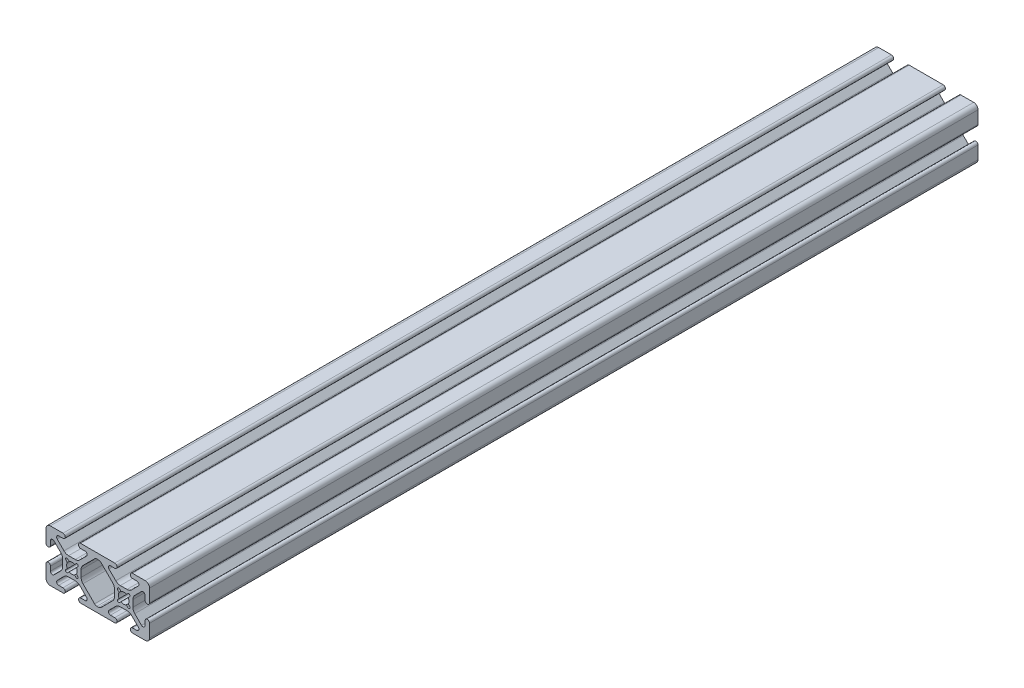
from build123d import *

# Parameters (mm, degrees)
EXTRUDE1_DEPTH = 406.4


with BuildPart() as part:
    # Sketch1 → Extrude1 (new body)
    with BuildSketch(Plane.XY):
        with BuildLine():
            Line((8.3439, -10.4902), (6.225100202, -10.4902))
            ThreePointArc((6.225100202, -10.4902), (5.286438597, -9.863006367), (5.506679712, -8.75577951))
            Line((5.506679712, -8.75577951), (8.81535611, -5.447103113))
            ThreePointArc((8.81535611, -5.447103113), (9.845400242, -4.758849627), (11.06042014, -4.517167143))
            Line((11.06042014, -4.517167143), (14.33957986, -4.517167143))
            ThreePointArc((14.33957986, -4.517167143), (15.554599758, -4.758849627), (16.58464389, -5.447103113))
            Line((16.58464389, -5.447103113), (19.893320288, -8.75577951))
            ThreePointArc((19.893320288, -8.75577951), (20.113561403, -9.863006367), (19.174899798, -10.4902))
            Line((19.174899798, -10.4902), (17.0561, -10.4902))
            ThreePointArc((17.0561, -10.4902), (15.9512, -11.5951), (17.0561, -12.7))
            Line((17.0561, -12.7), (23.2918, -12.7))
            ThreePointArc((23.2918, -12.7), (24.782522516, -12.082522516), (25.4, -10.5918))
            Line((25.4, -10.5918), (25.4, -4.3561))
            ThreePointArc((25.4, -4.3561), (24.2951, -3.2512), (23.1902, -4.3561))
            Line((23.1902, -4.3561), (23.1902, -6.474899798))
            ThreePointArc((23.1902, -6.474899798), (22.563006367, -7.413561403), (21.45577951, -7.193320288))
            Line((21.45577951, -7.193320288), (18.147103113, -3.88464389))
            ThreePointArc((18.147103113, -3.88464389), (17.458849627, -2.854599758), (17.217167143, -1.63957986))
            Line((17.217167143, -1.63957986), (17.217167143, 1.63957986))
            ThreePointArc((17.217167143, 1.63957986), (17.458849627, 2.854599758), (18.147103113, 3.88464389))
            Line((18.147103113, 3.88464389), (21.45577951, 7.193320288))
            ThreePointArc((21.45577951, 7.193320288), (22.563006367, 7.413561403), (23.1902, 6.474899798))
            Line((23.1902, 6.474899798), (23.1902, 4.3561))
            ThreePointArc((23.1902, 4.3561), (24.2951, 3.2512), (25.4, 4.3561))
            Line((25.4, 4.3561), (25.4, 10.5918))
            ThreePointArc((25.4, 10.5918), (24.782522516, 12.082522516), (23.2918, 12.7))
            Line((23.2918, 12.7), (17.0561, 12.7))
            ThreePointArc((17.0561, 12.7), (15.9512, 11.5951), (17.0561, 10.4902))
            Line((17.0561, 10.4902), (19.174899798, 10.4902))
            ThreePointArc((19.174899798, 10.4902), (20.113561403, 9.863006367), (19.893320288, 8.75577951))
            Line((19.893320288, 8.75577951), (16.58464389, 5.447103113))
            ThreePointArc((16.58464389, 5.447103113), (15.554599758, 4.758849627), (14.33957986, 4.517167143))
            Line((14.33957986, 4.517167143), (11.06042014, 4.517167143))
            ThreePointArc((11.06042014, 4.517167143), (9.845400242, 4.758849627), (8.81535611, 5.447103113))
            Line((8.81535611, 5.447103113), (5.506679712, 8.75577951))
            ThreePointArc((5.506679712, 8.75577951), (5.286438597, 9.863006367), (6.225100202, 10.4902))
            Line((6.225100202, 10.4902), (8.3439, 10.4902))
            ThreePointArc((8.3439, 10.4902), (9.4488, 11.5951), (8.3439, 12.7))
            Line((8.3439, 12.7), (-8.3439, 12.7))
            ThreePointArc((-8.3439, 12.7), (-9.4488, 11.5951), (-8.3439, 10.4902))
            Line((-8.3439, 10.4902), (-6.225100202, 10.4902))
            ThreePointArc((-6.225100202, 10.4902), (-5.286438597, 9.863006367), (-5.506679712, 8.75577951))
            Line((-5.506679712, 8.75577951), (-8.81535611, 5.447103113))
            ThreePointArc((-8.81535611, 5.447103113), (-9.845400242, 4.758849627), (-11.06042014, 4.517167143))
            Line((-11.06042014, 4.517167143), (-14.33957986, 4.517167143))
            ThreePointArc((-14.33957986, 4.517167143), (-15.554599758, 4.758849627), (-16.58464389, 5.447103113))
            Line((-16.58464389, 5.447103113), (-19.893320288, 8.75577951))
            ThreePointArc((-19.893320288, 8.75577951), (-20.113561403, 9.863006367), (-19.174899798, 10.4902))
            Line((-19.174899798, 10.4902), (-17.0561, 10.4902))
            ThreePointArc((-17.0561, 10.4902), (-15.9512, 11.5951), (-17.0561, 12.7))
            Line((-17.0561, 12.7), (-23.2918, 12.7))
            ThreePointArc((-23.2918, 12.7), (-24.782522516, 12.082522516), (-25.4, 10.5918))
            Line((-25.4, 10.5918), (-25.4, 4.3561))
            ThreePointArc((-25.4, 4.3561), (-24.2951, 3.2512), (-23.1902, 4.3561))
            Line((-23.1902, 4.3561), (-23.1902, 6.474899798))
            ThreePointArc((-23.1902, 6.474899798), (-22.563006367, 7.413561403), (-21.45577951, 7.193320288))
            Line((-21.45577951, 7.193320288), (-18.147103113, 3.88464389))
            ThreePointArc((-18.147103113, 3.88464389), (-17.458849627, 2.854599758), (-17.217167143, 1.63957986))
            Line((-17.217167143, 1.63957986), (-17.217167143, -1.63957986))
            ThreePointArc((-17.217167143, -1.63957986), (-17.458849627, -2.854599758), (-18.147103113, -3.88464389))
            Line((-18.147103113, -3.88464389), (-21.45577951, -7.193320288))
            ThreePointArc((-21.45577951, -7.193320288), (-22.563006367, -7.413561403), (-23.1902, -6.474899798))
            Line((-23.1902, -6.474899798), (-23.1902, -4.3561))
            ThreePointArc((-23.1902, -4.3561), (-24.2951, -3.2512), (-25.4, -4.3561))
            Line((-25.4, -4.3561), (-25.4, -10.5918))
            ThreePointArc((-25.4, -10.5918), (-24.782522516, -12.082522516), (-23.2918, -12.7))
            Line((-23.2918, -12.7), (-17.0561, -12.7))
            ThreePointArc((-17.0561, -12.7), (-15.9512, -11.5951), (-17.0561, -10.4902))
            Line((-17.0561, -10.4902), (-19.174899798, -10.4902))
            ThreePointArc((-19.174899798, -10.4902), (-20.113561403, -9.863006367), (-19.893320288, -8.75577951))
            Line((-19.893320288, -8.75577951), (-16.58464389, -5.447103113))
            ThreePointArc((-16.58464389, -5.447103113), (-15.554599758, -4.758849627), (-14.33957986, -4.517167143))
            Line((-14.33957986, -4.517167143), (-11.06042014, -4.517167143))
            ThreePointArc((-11.06042014, -4.517167143), (-9.845400242, -4.758849627), (-8.81535611, -5.447103113))
            Line((-8.81535611, -5.447103113), (-5.506679712, -8.75577951))
            ThreePointArc((-5.506679712, -8.75577951), (-5.286438597, -9.863006367), (-6.225100202, -10.4902))
            Line((-6.225100202, -10.4902), (-8.3439, -10.4902))
            ThreePointArc((-8.3439, -10.4902), (-9.4488, -11.5951), (-8.3439, -12.7))
            Line((-8.3439, -12.7), (8.3439, -12.7))
            ThreePointArc((8.3439, -12.7), (9.4488, -11.5951), (8.3439, -10.4902))
        make_face()
        with BuildLine():
            Line((-14.040533428, -2.231856263), (-14.669151357, -2.860474191))
            ThreePointArc((-14.669151357, -2.860474191), (-15.618583239, -2.918583239), (-15.560474191, -1.969151357))
            Line((-15.560474191, -1.969151357), (-14.931856263, -1.340533428))
            ThreePointArc((-14.931856263, -1.340533428), (-15.3035, 0), (-14.931856263, 1.340533428))
            Line((-14.931856263, 1.340533428), (-15.560474191, 1.969151357))
            ThreePointArc((-15.560474191, 1.969151357), (-15.618583239, 2.918583239), (-14.669151357, 2.860474191))
            Line((-14.669151357, 2.860474191), (-14.040533428, 2.231856263))
            ThreePointArc((-14.040533428, 2.231856263), (-12.7, 2.6035), (-11.359466572, 2.231856263))
            Line((-11.359466572, 2.231856263), (-10.730848643, 2.860474191))
            ThreePointArc((-10.730848643, 2.860474191), (-9.781416761, 2.918583239), (-9.839525809, 1.969151357))
            Line((-9.839525809, 1.969151357), (-10.468143737, 1.340533428))
            ThreePointArc((-10.468143737, 1.340533428), (-10.0965, 0), (-10.468143737, -1.340533428))
            Line((-10.468143737, -1.340533428), (-9.839525809, -1.969151357))
            ThreePointArc((-9.839525809, -1.969151357), (-9.781416761, -2.918583239), (-10.730848643, -2.860474191))
            Line((-10.730848643, -2.860474191), (-11.359466572, -2.231856263))
            ThreePointArc((-11.359466572, -2.231856263), (-12.7, -2.6035), (-14.040533428, -2.231856263))
        make_face(mode=Mode.SUBTRACT)
        with BuildLine():
            Line((14.669151357, -2.860474191), (14.040533428, -2.231856263))
            ThreePointArc((14.040533428, -2.231856263), (12.7, -2.6035), (11.359466572, -2.231856263))
            Line((11.359466572, -2.231856263), (10.730848643, -2.860474191))
            ThreePointArc((10.730848643, -2.860474191), (9.781416761, -2.918583239), (9.839525809, -1.969151357))
            Line((9.839525809, -1.969151357), (10.468143737, -1.340533428))
            ThreePointArc((10.468143737, -1.340533428), (10.0965, 0), (10.468143737, 1.340533428))
            Line((10.468143737, 1.340533428), (9.839525809, 1.969151357))
            ThreePointArc((9.839525809, 1.969151357), (9.781416761, 2.918583239), (10.730848643, 2.860474191))
            Line((10.730848643, 2.860474191), (11.359466572, 2.231856263))
            ThreePointArc((11.359466572, 2.231856263), (12.7, 2.6035), (14.040533428, 2.231856263))
            Line((14.040533428, 2.231856263), (14.669151357, 2.860474191))
            ThreePointArc((14.669151357, 2.860474191), (15.618583239, 2.918583239), (15.560474191, 1.969151357))
            Line((15.560474191, 1.969151357), (14.931856263, 1.340533428))
            ThreePointArc((14.931856263, 1.340533428), (15.3035, 0), (14.931856263, -1.340533428))
            Line((14.931856263, -1.340533428), (15.560474191, -1.969151357))
            ThreePointArc((15.560474191, -1.969151357), (15.618583239, -2.918583239), (14.669151357, -2.860474191))
        make_face(mode=Mode.SUBTRACT)
        with BuildLine():
            Line((-0.45223726, 10.033), (0.45223726, 10.033))
            ThreePointArc((0.45223726, 10.033), (1.054887129, 9.913125488), (1.565789019, 9.571751759))
            Line((1.565789019, 9.571751759), (7.252896887, 3.88464389))
            ThreePointArc((7.252896887, 3.88464389), (7.941150373, 2.854599758), (8.182832857, 1.63957986))
            Line((8.182832857, 1.63957986), (8.182832857, -1.63957986))
            ThreePointArc((8.182832857, -1.63957986), (7.941150373, -2.854599758), (7.252896887, -3.88464389))
            Line((7.252896887, -3.88464389), (1.565789019, -9.571751759))
            ThreePointArc((1.565789019, -9.571751759), (1.054887129, -9.913125488), (0.45223726, -10.033))
            Line((0.45223726, -10.033), (-0.45223726, -10.033))
            ThreePointArc((-0.45223726, -10.033), (-1.054887129, -9.913125488), (-1.565789019, -9.571751759))
            Line((-1.565789019, -9.571751759), (-7.252896887, -3.88464389))
            ThreePointArc((-7.252896887, -3.88464389), (-7.941150373, -2.854599758), (-8.182832857, -1.63957986))
            Line((-8.182832857, -1.63957986), (-8.182832857, 1.63957986))
            ThreePointArc((-8.182832857, 1.63957986), (-7.941150373, 2.854599758), (-7.252896887, 3.88464389))
            Line((-7.252896887, 3.88464389), (-1.565789019, 9.571751759))
            ThreePointArc((-1.565789019, 9.571751759), (-1.054887129, 9.913125488), (-0.45223726, 10.033))
        make_face(mode=Mode.SUBTRACT)
    extrude(amount=-EXTRUDE1_DEPTH)


solid = part.part
